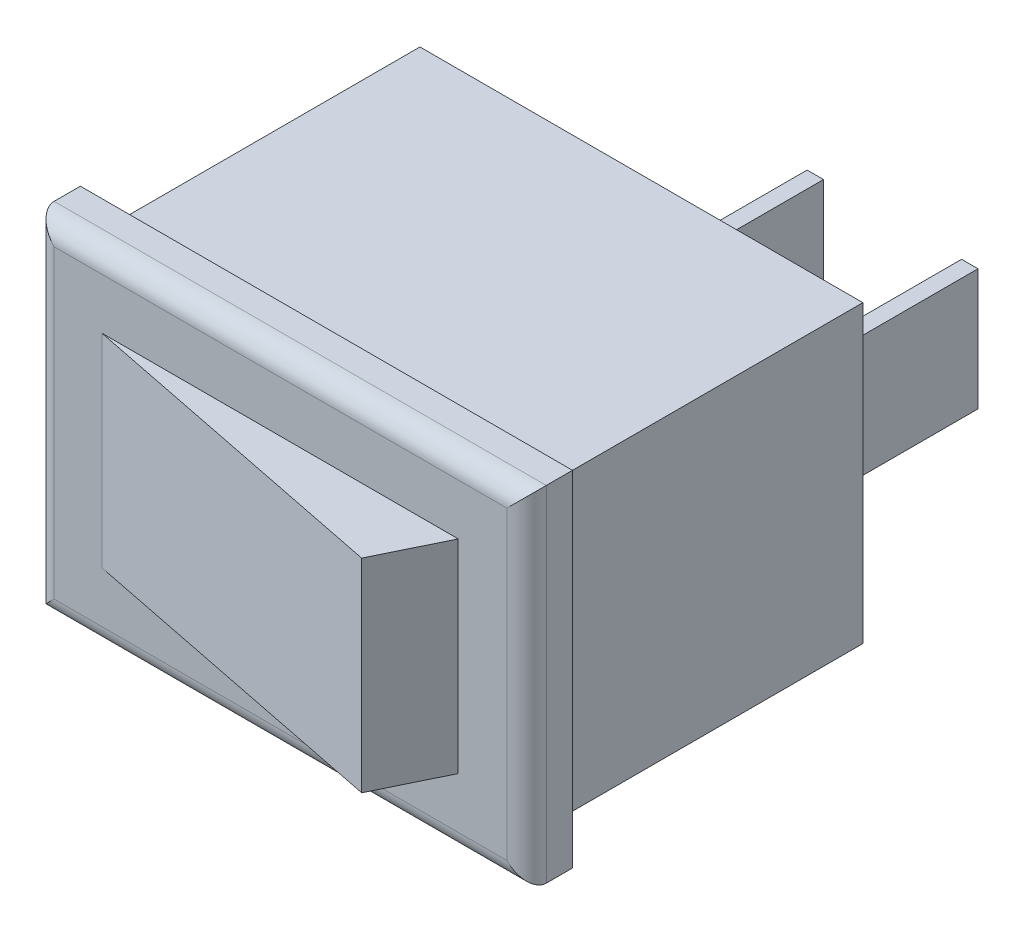
from build123d import *

# Parameters (mm, degrees)
SKETCH_1_W      = 15
SKETCH_1_H      = 10.5
EXTRUDE_1_DEPTH = 1.4
EXTRUDE_2_DEPTH = 6.194784772
SKETCH_3_W      = 13.5
SKETCH_3_H      = 9
EXTRUDE_3_DEPTH = 9.6
SKETCH_4_W      = 1.830527318
SKETCH_4_H      = 5
EXTRUDE_4_DEPTH = 0.3
SKETCH_5_W      = 0.5
SKETCH_5_H      = 3.7
EXTRUDE_5_DEPTH = 5
SKETCH_6_W      = 1.830527318
SKETCH_6_H      = 5
EXTRUDE_6_DEPTH = 0.3
SKETCH_7_W      = 0.5
SKETCH_7_H      = 3.7
EXTRUDE_7_DEPTH = 5
DRAFT_1_ANGLE   = 26
FILLET_1_R      = 0.6


with BuildPart() as part:
    # 草图1 → 凸台-拉伸1 (new body)
    with BuildSketch(Plane.XY.offset(11)):
        Rectangle(SKETCH_1_W, SKETCH_1_H)
    extrude(amount=-EXTRUDE_1_DEPTH)

    # 草图2 → 凸台-拉伸2 (add)
    with BuildSketch(Plane.XZ.offset(3.097392386)):
        Polygon((5.416790428, 11), (5.416790428, 13.171623136), (-5.441325251, 11), align=None)
    extrude(amount=-EXTRUDE_2_DEPTH)

    # 草图3 → 凸台-拉伸3 (add)
    with BuildSketch(Plane(origin=(0, 0, 9.6), x_dir=(-1, 0, 0), z_dir=(0, 0, -1))):
        Rectangle(SKETCH_3_W, SKETCH_3_H)
    extrude(amount=EXTRUDE_3_DEPTH)

    # 草图4 → 凸台-拉伸4 (add)
    with BuildSketch(Plane(origin=(0, 0, 0), x_dir=(-1, 0, 0), z_dir=(0, 0, -1))):
        Rectangle(SKETCH_4_W, SKETCH_4_H)
    extrude(amount=EXTRUDE_4_DEPTH)

    # 草图5 → 凸台-拉伸5 (add)
    with BuildSketch(Plane(origin=(0, 0, -0.3), x_dir=(-1, 0, 0), z_dir=(0, 0, -1))):
        Rectangle(SKETCH_5_W, SKETCH_5_H)
    extrude(amount=EXTRUDE_5_DEPTH)

    # 草图6 → 凸台-拉伸6 (add)
    with BuildSketch(Plane(origin=(0, 0, 0), x_dir=(-1, 0, 0), z_dir=(0, 0, -1))):
        with Locations((-4.709769509, 0)):
            Rectangle(SKETCH_6_W, SKETCH_6_H)
    extrude(amount=EXTRUDE_6_DEPTH)

    # 草图7 → 凸台-拉伸7 (add)
    with BuildSketch(Plane(origin=(0, 0, -0.3), x_dir=(-1, 0, 0), z_dir=(0, 0, -1))):
        with Locations((-4.709769509, 0)):
            Rectangle(SKETCH_7_W, SKETCH_7_H)
    extrude(amount=EXTRUDE_7_DEPTH)

    # 拔模1
    draft_1_faces = [part.faces().sort_by_distance(p)[0] for p in [
        (5.416790428, 0, 12.085811568),
    ]]
    draft(draft_1_faces, Plane.XY.offset(11), DRAFT_1_ANGLE)

    # 圆角1
    fillet_1_edges = [part.edges().sort_by_distance(p)[0] for p in [
        (7.5, 0, 11),
        (0, -5.25, 11),
        (-7.5, 0, 11),
        (0, 5.25, 11),
    ]]
    fillet(fillet_1_edges, radius=FILLET_1_R)


solid = part.part
